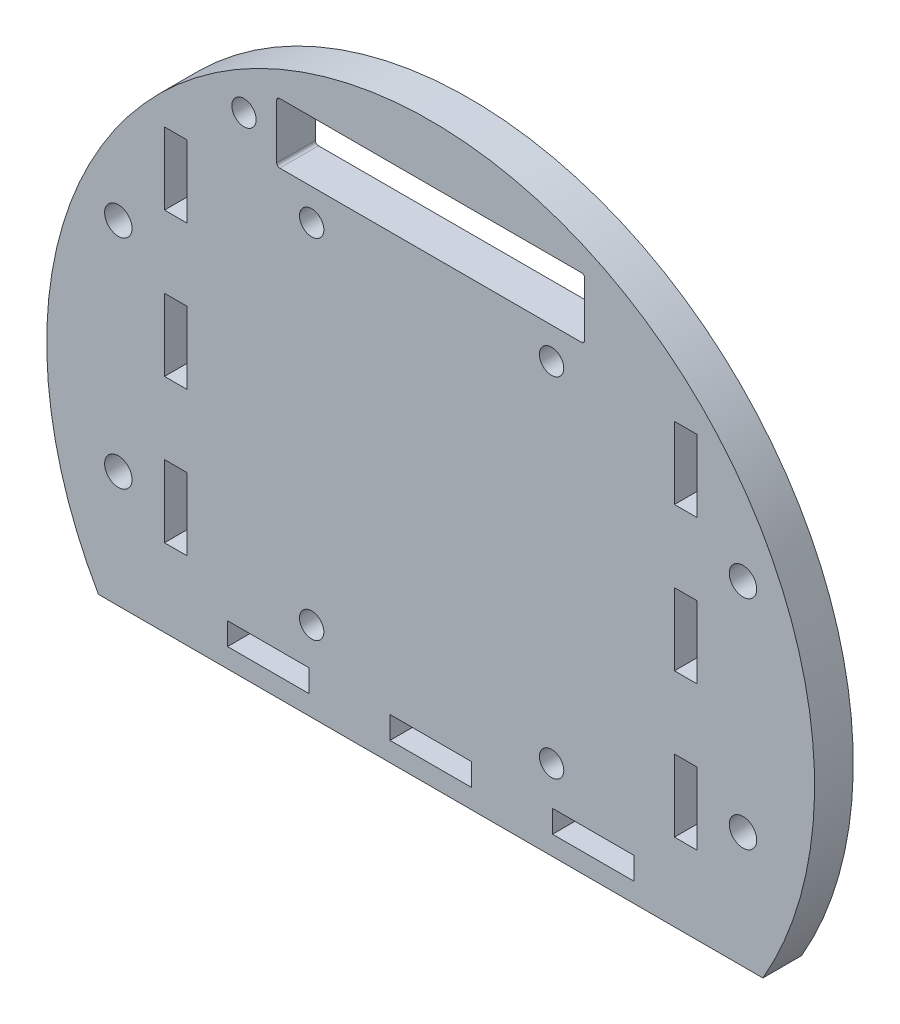
from build123d import *

# Parameters (mm, degrees)
SKETCH1_R           = 2.25
SKETCH1_R_2         = 2
SKETCH1_W           = 13.333333333
SKETCH1_H           = 3.675
SKETCH1_W_2         = 13.333333334
SKETCH1_W_3         = 3.675
SKETCH1_H_2         = 11.818181818
BOSS_EXTRUDE1_DEPTH = 6.35


with BuildPart() as part:
    # Sketch1 → Boss-Extrude1 (new body)
    with BuildSketch(Plane.XY):
        with BuildLine():
            Line((-54.514802885, -31.577464534), (54.514802885, -31.577464534))
            ThreePointArc((54.514802885, -31.577464534), (0, 63), (-54.514802885, -31.577464534))
        make_face()
        with Locations((-51.25, 23.184046239)):
            Circle(SKETCH1_R, mode=Mode.SUBTRACT)
        with Locations((-51.25, -12.496398734)):
            Circle(SKETCH1_R, mode=Mode.SUBTRACT)
        with Locations((-30.629163068, 48.823601552)):
            Circle(SKETCH1_R_2, mode=Mode.SUBTRACT)
        with Locations((51.25, 23.184046239)):
            Circle(SKETCH1_R, mode=Mode.SUBTRACT)
        with Locations((51.25, -12.496398734)):
            Circle(SKETCH1_R, mode=Mode.SUBTRACT)
        with Locations((-19.525679125, 38.728601552)):
            Circle(SKETCH1_R_2, mode=Mode.SUBTRACT)
        with Locations((-19.525679125, -18.421398448)):
            Circle(SKETCH1_R_2, mode=Mode.SUBTRACT)
        with Locations((19.844320875, -18.421398448)):
            Circle(SKETCH1_R_2, mode=Mode.SUBTRACT)
        with Locations((19.844320875, 38.728601552)):
            Circle(SKETCH1_R_2, mode=Mode.SUBTRACT)
        with Locations((26.666666666, -26.564964534)):
            Rectangle(SKETCH1_W, SKETCH1_H, mode=Mode.SUBTRACT)
        with Locations((0, -26.564964534)):
            Rectangle(SKETCH1_W_2, SKETCH1_H, mode=Mode.SUBTRACT)
        with Locations((-26.666666666, -26.564964534)):
            Rectangle(SKETCH1_W, SKETCH1_H, mode=Mode.SUBTRACT)
        with Locations((-41.8375, -12.909282716)):
            Rectangle(SKETCH1_W_3, SKETCH1_H_2, mode=Mode.SUBTRACT)
        with Locations((-41.8375, 10.727080921)):
            Rectangle(SKETCH1_W_3, SKETCH1_H_2, mode=Mode.SUBTRACT)
        with Locations((-41.8375, 34.363444557)):
            Rectangle(SKETCH1_W_3, SKETCH1_H_2, mode=Mode.SUBTRACT)
        with Locations((41.8375, -12.909282716)):
            Rectangle(SKETCH1_W_3, SKETCH1_H_2, mode=Mode.SUBTRACT)
        with Locations((41.8375, 10.727080921)):
            Rectangle(SKETCH1_W_3, SKETCH1_H_2, mode=Mode.SUBTRACT)
        with Locations((41.8375, 34.363444557)):
            Rectangle(SKETCH1_W_3, SKETCH1_H_2, mode=Mode.SUBTRACT)
        with BuildLine():
            Line((25.265, 44.378601552), (25.265, 53.268601552))
            ThreePointArc((25.265, 53.268601552), (25.118553391, 53.622154943), (24.765, 53.768601552))
            Line((24.765, 53.768601552), (-24.765, 53.768601552))
            ThreePointArc((-24.765, 53.768601552), (-25.118553391, 53.622154943), (-25.265, 53.268601552))
            Line((-25.265, 53.268601552), (-25.265, 44.378601552))
            ThreePointArc((-25.265, 44.378601552), (-25.118553391, 44.025048162), (-24.765, 43.878601552))
            Line((-24.765, 43.878601552), (24.765, 43.878601552))
            ThreePointArc((24.765, 43.878601552), (25.118553391, 44.025048162), (25.265, 44.378601552))
        make_face(mode=Mode.SUBTRACT)
    extrude(amount=-BOSS_EXTRUDE1_DEPTH)


solid = part.part
